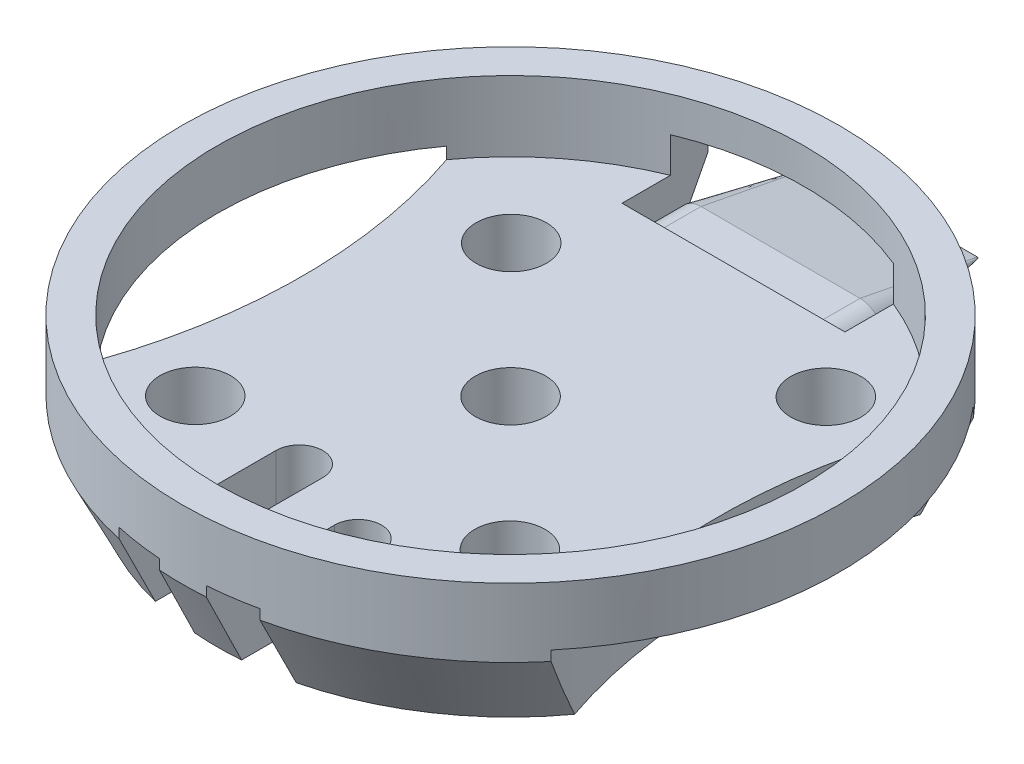
from build123d import *
from OCP.BRepFilletAPI import BRepFilletAPI_MakeChamfer

# Parameters (mm, degrees)
SCHIZZO1_R                   = 14
ESTRUSIONE_ESTRUSIONE1_DEPTH = 6
SCHIZZO2_W                   = 9.5
SCHIZZO2_H                   = 5
TAGLIO_ESTRUSIONE1_DEPTH     = 4.5
SCHIZZO3_R                   = 12.5
TAGLIO_ESTRUSIONE2_DEPTH     = 3
TAGLIO_ESTRUSIONE4_DEPTH     = 3.5
SMUSSO1_SIZE                 = 1.5
SMUSSO1_SIZE2                = 3.075455762
SCHIZZO8_R                   = 22.778601144
TAGLIO_ESTRUSIONE6_DEPTH     = 3.5
ESTRUSIONE_ESTRUSIONE2_DEPTH = 7
SMUSSO2_SIZE                 = 5
SMUSSO2_SIZE2                = 0.971901546
SCHIZZO14_R                  = 1.5
TAGLIO_ESTRUSIONE10_DEPTH    = 23.455511573
SCHIZZO17_R                  = 1.5
TAGLIO_ESTRUSIONE12_DEPTH    = 32


with BuildPart() as part:
    # Schizzo1 → Estrusione-Estrusione1 (new body)
    with BuildSketch(Plane(origin=(0, 0, 0), x_dir=(1, 0, 0), z_dir=(0, 1, 0))):
        with Locations(Location((0, 0, 0), (0, 0, 270))):
            Circle(SCHIZZO1_R)
    extrude(amount=ESTRUSIONE_ESTRUSIONE1_DEPTH)

    # Schizzo2 → Taglio-Estrusione1 (cut)
    with BuildSketch(Plane.XZ):
        with Locations((0, -12)):
            Rectangle(SCHIZZO2_W, SCHIZZO2_H)
    extrude(amount=-TAGLIO_ESTRUSIONE1_DEPTH, mode=Mode.SUBTRACT)

    # Schizzo3 → Taglio-Estrusione2 (cut)
    with BuildSketch(Plane(origin=(0, 6, 0), x_dir=(1, 0, 0), z_dir=(0, 1, 0))):
        with Locations(Location((0, 0, 0), (0, 0, 270))):
            Circle(SCHIZZO3_R)
    extrude(amount=-TAGLIO_ESTRUSIONE2_DEPTH, mode=Mode.SUBTRACT)

    # Schizzo4 → Taglio-Estrusione4 (cut)
    with BuildSketch(Plane.XZ):
        with BuildLine():
            Line((-1, 7), (-1, 13.964240044))
            ThreePointArc((-1, 13.964240044), (-2.00522934, 13.855650663), (-3, 13.674794331))
            Line((-3, 13.674794331), (-3, 7))
            ThreePointArc((-3, 7), (-2, 6), (-1, 7))
        make_face()
        with BuildLine():
            ThreePointArc((3, 13.674794331), (2.00522934, 13.855650663), (1, 13.964240044))
            Line((1, 13.964240044), (1, 8.5))
            ThreePointArc((1, 8.5), (2, 7.5), (3, 8.5))
            Line((3, 8.5), (3, 13.674794331))
        make_face()
    extrude(amount=-TAGLIO_ESTRUSIONE4_DEPTH, mode=Mode.SUBTRACT)

    # Smusso1
    smusso1_edges = [part.edges().sort_by_distance(p)[0] for p in [
        (0.500319591, 0, 13.991057155),
        (-13.970345786, 0, 0.910735206),
        (13.970345786, 0, 0.910735206),
    ]]
    smusso1_side = [part.faces().sort_by_distance(p)[0] for p in [
        (0.010947271, 0, 0.331138895),
    ]]
    chamfer(smusso1_edges, length=SMUSSO1_SIZE, length2=SMUSSO1_SIZE2, reference=smusso1_side[0])

    # Schizzo8 → Taglio-Estrusione6 (cut)
    with BuildSketch(Plane.XZ):
        with Locations((-31.649021425, 0)):
            Circle(SCHIZZO8_R)
        with Locations((31.649021425, 0)):
            Circle(SCHIZZO8_R)
    extrude(amount=-TAGLIO_ESTRUSIONE6_DEPTH, mode=Mode.SUBTRACT)

    # Schizzo10 → Estrusione-Estrusione2 (add)
    with BuildSketch(Plane(origin=(0, 0, -9.5), x_dir=(-1, 0, 0), z_dir=(0, 0, -1))):
        with BuildLine():
            Line((-3.389234254, 2.559575442), (3.389234254, 2.559575442))
            ThreePointArc((3.389234254, 2.559575442), (4.389234254, 1.559575442), (3.389234254, 0.559575442))
            Line((3.389234254, 0.559575442), (-3.389234254, 0.559575442))
            ThreePointArc((-3.389234254, 0.559575442), (-4.389234254, 1.559575442), (-3.389234254, 2.559575442))
        make_face()
    extrude(amount=ESTRUSIONE_ESTRUSIONE2_DEPTH)

    # Smusso2: one chamfer whose edges measure the first distance from different faces: ONE call of the kernel's chamfer builder (chamfer() names one face for all edges)
    smusso2_edges_1 = [part.edges().sort_by_distance(p)[0] for p in [
        (4.389234254, 1.559575442, -16.5),
    ]]
    smusso2_side_1 = [part.faces().sort_by_distance(p)[0] for p in [
        (4.389234254, 1.559575442, -13),
    ]]
    smusso2_edges_2 = [part.edges().sort_by_distance(p)[0] for p in [
        (0, 0.559575442, -16.5),
    ]]
    smusso2_side_2 = [part.faces().sort_by_distance(p)[0] for p in [
        (0, 0.559575442, -13),
    ]]
    smusso2_edges_3 = [part.edges().sort_by_distance(p)[0] for p in [
        (-4.389234254, 1.559575442, -16.5),
    ]]
    smusso2_side_3 = [part.faces().sort_by_distance(p)[0] for p in [
        (-4.389234254, 1.559575442, -13),
    ]]
    smusso2_edges_4 = [part.edges().sort_by_distance(p)[0] for p in [
        (0, 2.559575442, -16.5),
    ]]
    smusso2_side_4 = [part.faces().sort_by_distance(p)[0] for p in [
        (0, 2.559575442, -13),
    ]]
    smusso2 = BRepFilletAPI_MakeChamfer(part.part.solid().wrapped)
    for e in smusso2_edges_1:
        smusso2.Add(SMUSSO2_SIZE, SMUSSO2_SIZE2, e.wrapped, smusso2_side_1[0].wrapped)  # the first distance lies on this face
    for e in smusso2_edges_2:
        smusso2.Add(SMUSSO2_SIZE, SMUSSO2_SIZE2, e.wrapped, smusso2_side_2[0].wrapped)  # the first distance lies on this face
    for e in smusso2_edges_3:
        smusso2.Add(SMUSSO2_SIZE, SMUSSO2_SIZE2, e.wrapped, smusso2_side_3[0].wrapped)  # the first distance lies on this face
    for e in smusso2_edges_4:
        smusso2.Add(SMUSSO2_SIZE, SMUSSO2_SIZE2, e.wrapped, smusso2_side_4[0].wrapped)  # the first distance lies on this face
    add(Compound.cast(smusso2.Shape()), mode=Mode.REPLACE)

    # Schizzo14 → Taglio-Estrusione10 (cut, through all)
    with BuildSketch(Plane.XZ):
        with Locations(Location((6.733876165, -6.701112728, 0), (0, 0, 270))):
            Circle(SCHIZZO14_R)
        with Locations(Location((-6.733876165, 6.701112728, 0), (0, 0, 270))):
            Circle(SCHIZZO14_R)
        with Locations(Location((5.643042298, 5.67063256, 0), (0, 0, 270))):
            Circle(SCHIZZO14_R)
        with Locations(Location((-5.643042298, -5.67063256, 0), (0, 0, 270))):
            Circle(SCHIZZO14_R)
    extrude(amount=-TAGLIO_ESTRUSIONE10_DEPTH, mode=Mode.SUBTRACT)

    # Schizzo17 → Taglio-Estrusione12 (cut)
    with BuildSketch(Plane.XZ):
        with Locations(Location((0, 0, 0), (0, 0, 270))):
            Circle(SCHIZZO17_R)
    extrude(amount=-TAGLIO_ESTRUSIONE12_DEPTH, mode=Mode.SUBTRACT)


solid = part.part
